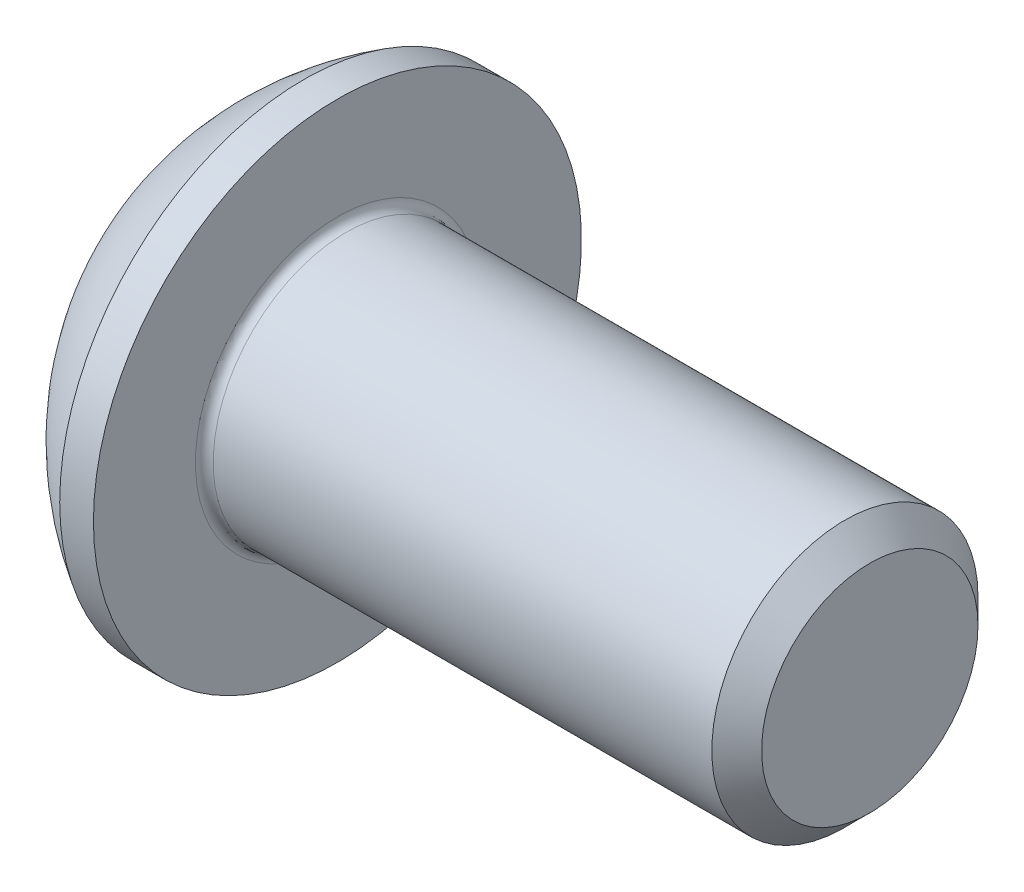
from build123d import *

# Parameters (mm, degrees)
CUT_EXTRUDE1_DEPTH        = 1.04
SKETCH4_R                 = 1.5
LARGO_Y_ANCHO_ROSCA_DEPTH = 6
FILLET1_R                 = 0.1
CHAMFER1_SIZE             = 0.2805


with BuildPart() as part:
    # Sketch1 → Revolve1 (revolve)
    with BuildSketch(Plane(origin=(0, 0, 0), x_dir=(-1, 0, 0), z_dir=(0, 0, -1)), mode=Mode.PRIVATE) as revolve1_sk:
        with BuildLine():
            Line((-1.65, 2.75), (-1.65, 0))
            Line((-1.65, 0), (0, 0))
            Line((0, 0), (0, 1.425))
            ThreePointArc((0, 1.425), (-0.542530893, 2.176130767), (-1.27, 2.75))
            Line((-1.27, 2.75), (-1.65, 2.75))
        make_face()
    revolve(revolve1_sk.sketch.rotate(Axis((1.65, 0, 0), (-1, 0, 0)), 270), axis=Axis((1.65, 0, 0), (-1, 0, 0)))

    # Sketch2 → Cut-Extrude1 (cut)
    with BuildSketch(Plane.ZY):
        Polygon((-1, 0.577350269), (-1, -0.577350269), (0, -1.154700538), (1, -0.577350269), (1, 0.577350269), (0, 1.154700538), align=None)
    extrude(amount=-CUT_EXTRUDE1_DEPTH, mode=Mode.SUBTRACT)

    # Sketch3 → Cut-Revolve1 (revolve, cut)
    with BuildSketch(Plane.XY, mode=Mode.PRIVATE) as cut_revolve1_sk:
        Polygon((1.04, 1), (1.04, 0), (1.617350269, 0), align=None)
    revolve(cut_revolve1_sk.sketch.rotate(Axis((1.04, 0, 0), (1, 0, 0)), 90), axis=Axis((1.04, 0, 0), (1, 0, 0)), mode=Mode.SUBTRACT)

    # Sketch4 → Largo y Ancho rosca (add)
    with BuildSketch(Plane(origin=(1.65, 0, 0), x_dir=(0, 0, -1), z_dir=(1, 0, 0))):
        Circle(SKETCH4_R)
    extrude(amount=LARGO_Y_ANCHO_ROSCA_DEPTH)

    # Fillet1
    fillet1_edges = [part.edges().sort_by_distance(p)[0] for p in [
        (1.65, 0, 1.5),
    ]]
    fillet(fillet1_edges, radius=FILLET1_R)

    # Chamfer1
    chamfer1_edges = [part.edges().sort_by_distance(p)[0] for p in [
        (7.65, 0, 1.5),
    ]]
    chamfer(chamfer1_edges, length=CHAMFER1_SIZE)


solid = part.part
